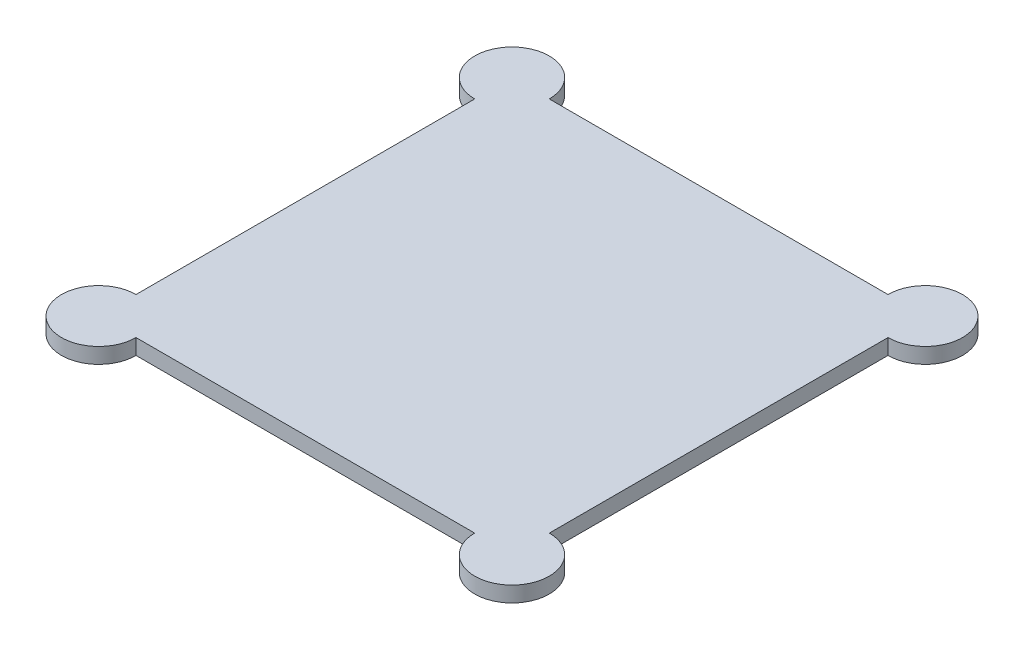
from build123d import *

# Parameters (mm, degrees)
SKETCH_1_R      = 24
SKETCH_1_W      = 266
SKETCH_1_H      = 266
EXTRUDE_1_DEPTH = 10


with BuildPart() as part:
    # 草图1 → 凸台-拉伸1 (new body)
    with BuildSketch(Plane(origin=(0, 0, 0), x_dir=(1, 0, 0), z_dir=(0, 1, 0))):
        with BuildLine():
            Line((-133, 109), (-133, 133))
            Line((-133, 133), (-109, 133))
            ThreePointArc((-109, 133), (-149.970562748, 149.970562748), (-133, 109))
        make_face()
        with BuildLine():
            Line((-109, 133), (-133, 133))
            Line((-133, 133), (-133, 109))
            ThreePointArc((-133, 109), (-116.029437252, 116.029437252), (-109, 133))
        make_face()
        with Locations((-133, -133)):
            Circle(SKETCH_1_R)
        with Locations((133, -133)):
            Circle(SKETCH_1_R)
        with Locations((133, 133)):
            Circle(SKETCH_1_R)
        with Locations((-133, 133)):
            Circle(SKETCH_1_R)
        Rectangle(SKETCH_1_W, SKETCH_1_H)
        with BuildLine():
            ThreePointArc((157, 133), (133, 157), (109, 133))
            Line((109, 133), (133, 133))
            Line((133, 133), (133, 109))
            ThreePointArc((133, 109), (149.970562748, 116.029437252), (157, 133))
        make_face()
        with BuildLine():
            Line((133, 133), (109, 133))
            ThreePointArc((109, 133), (116.029437252, 116.029437252), (133, 109))
            Line((133, 109), (133, 133))
        make_face()
        with BuildLine():
            ThreePointArc((157, -133), (149.970562748, -116.029437252), (133, -109))
            Line((133, -109), (133, -133))
            Line((133, -133), (109, -133))
            ThreePointArc((109, -133), (133, -157), (157, -133))
        make_face()
        with BuildLine():
            Line((133, -133), (133, -109))
            ThreePointArc((133, -109), (116.029437252, -116.029437252), (109, -133))
            Line((109, -133), (133, -133))
        make_face()
        with BuildLine():
            ThreePointArc((-109, -133), (-116.029437252, -116.029437252), (-133, -109))
            Line((-133, -109), (-133, -133))
            Line((-133, -133), (-109, -133))
        make_face()
        with BuildLine():
            Line((-133, -133), (-133, -109))
            ThreePointArc((-133, -109), (-149.970562748, -149.970562748), (-109, -133))
            Line((-109, -133), (-133, -133))
        make_face()
    extrude(amount=EXTRUDE_1_DEPTH)


solid = part.part
